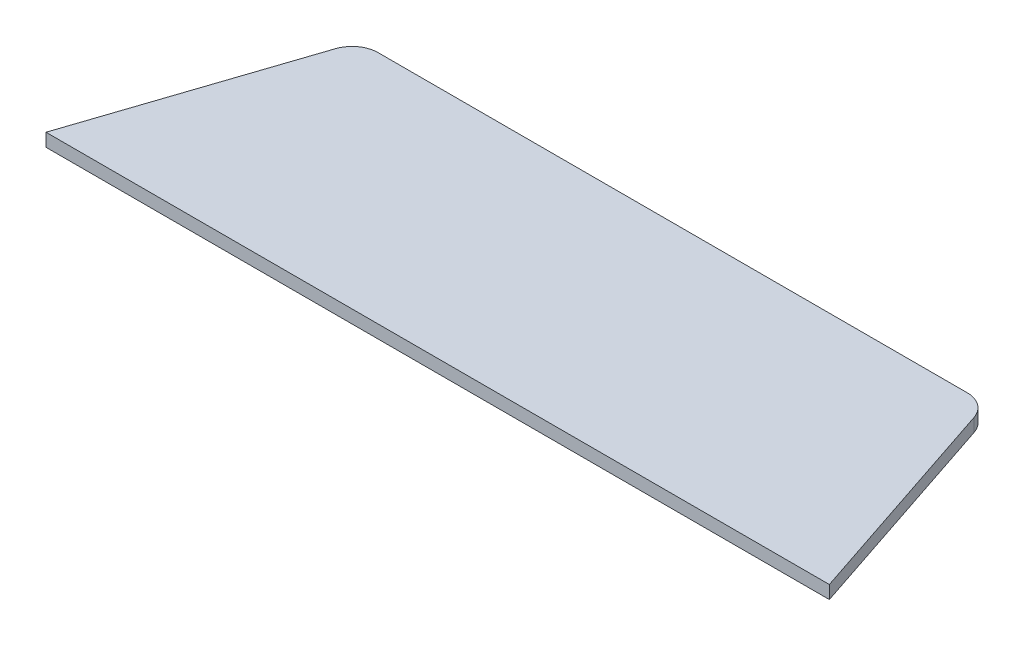
from build123d import *

# Parameters (mm, degrees)
BOSS_EXTRUDE1_DEPTH = 5
FILLET1_R           = 10


with BuildPart() as part:
    # Sketch1 → Boss-Extrude1 (new body)
    with BuildSketch(Plane(origin=(0, 0, 0), x_dir=(1, 0, 0), z_dir=(0, 1, 0))):
        Polygon((0, 0), (30, 90), (270, 90), (300, 0), align=None)
    extrude(amount=BOSS_EXTRUDE1_DEPTH)

    # Fillet1
    fillet1_edges = [part.edges().sort_by_distance(p)[0] for p in [
        (30, 2.5, -90),
        (270, 2.5, -90),
    ]]
    fillet(fillet1_edges, radius=FILLET1_R)


solid = part.part
